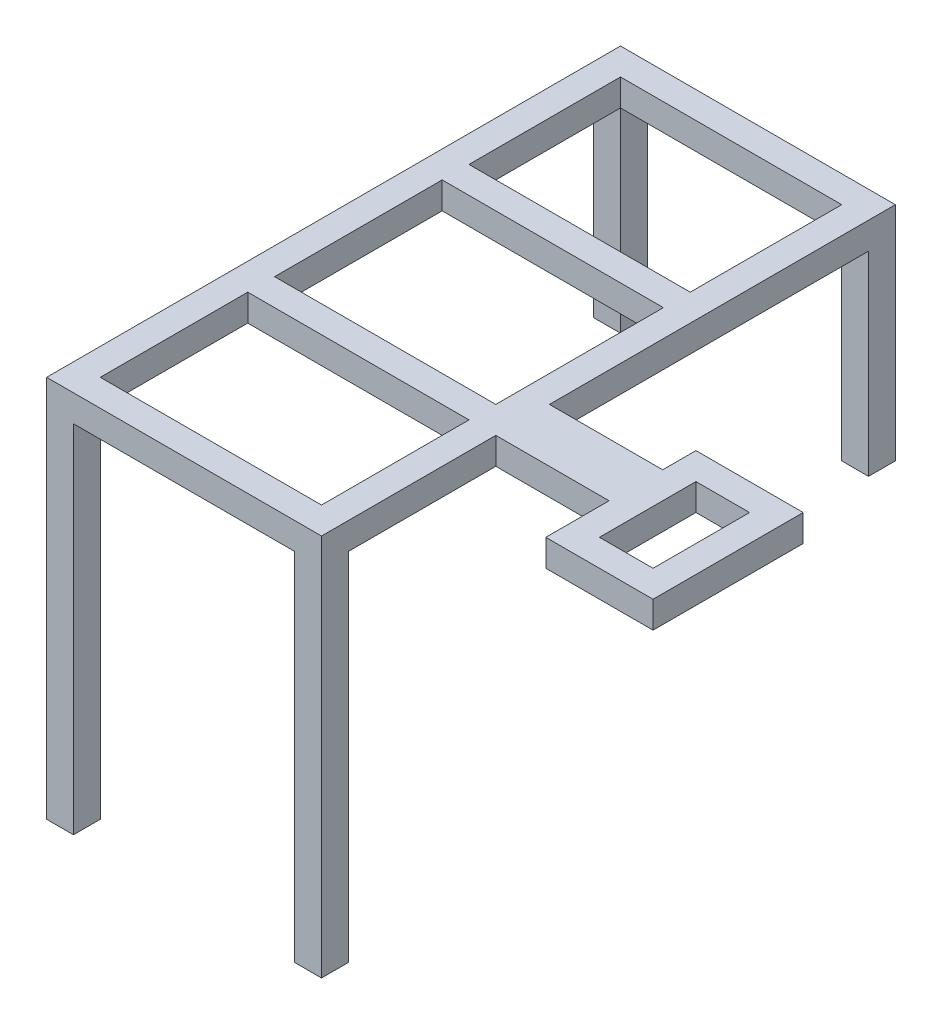
from build123d import *

# Parameters (mm, degrees)
SKETCH2_W           = 260.35
SKETCH2_H           = 209.55
SKETCH2_W_2         = 209.55
SKETCH2_H_2         = 158.75
SKETCH2_W_3         = 50.8
SKETCH2_H_3         = 91.44
SKETCH2_W_4         = 107.2896
SKETCH2_H_4         = 50.8
BOSS_EXTRUDE1_DEPTH = 25.4
SKETCH3_W           = 260.35
SKETCH3_H           = 543.56
SKETCH3_W_2         = 209.55
SKETCH3_H_2         = 492.76
BOSS_EXTRUDE2_DEPTH = 25.4
SKETCH4_W           = 25.4
SKETCH4_H           = 25.4
BOSS_EXTRUDE3_DEPTH = 184.785
SKETCH5_W           = 25.4
SKETCH5_H           = 25.4
BOSS_EXTRUDE4_DEPTH = 337.185


with BuildPart() as part:
    # Sketch2 → Boss-Extrude1 (new body)
    # profile 1 of 3: a face of its own
    with BuildSketch(Plane(origin=(0, 0, 0), x_dir=(1, 0, 0), z_dir=(0, 1, 0))):
        with Locations((104.775, -79.375)):
            Rectangle(SKETCH2_W, SKETCH2_H)
        with Locations((104.775, -79.375)):
            Rectangle(SKETCH2_W_2, SKETCH2_H_2, mode=Mode.SUBTRACT)
    # profile 2 of 3: a face of its own
    with BuildSketch(Plane(origin=(0, 0, 0), x_dir=(1, 0, 0), z_dir=(0, 1, 0))):
        Polygon((342.2396, -133.35), (342.2396, -184.15), (342.2396, -244.094), (443.8396, -244.094), (443.8396, -101.854), (342.2396, -101.854), align=None)
        with Locations((393.0396, -172.974)):
            Rectangle(SKETCH2_W_3, SKETCH2_H_3, mode=Mode.SUBTRACT)
    # profile 3 of 3: a face of its own
    with BuildSketch(Plane(origin=(0, 0, 0), x_dir=(1, 0, 0), z_dir=(0, 1, 0))):
        with Locations((288.5948, -158.75)):
            Rectangle(SKETCH2_W_4, SKETCH2_H_4)
    extrude(amount=BOSS_EXTRUDE1_DEPTH)

    # Sketch3 → Boss-Extrude2 (add)
    with BuildSketch(Plane(origin=(0, 25.4, 0), x_dir=(1, 0, 0), z_dir=(0, 1, 0))):
        with Locations((104.775, -77.47)):
            Rectangle(SKETCH3_W, SKETCH3_H)
        with Locations((104.775, -77.47)):
            Rectangle(SKETCH3_W_2, SKETCH3_H_2, mode=Mode.SUBTRACT)
    extrude(amount=-BOSS_EXTRUDE2_DEPTH)

    # Sketch4 → Boss-Extrude3 (add)
    with BuildSketch(Plane.XZ):
        with Locations((-12.7, -181.61)):
            Rectangle(SKETCH4_W, SKETCH4_H)
        with Locations((222.25, -181.61)):
            Rectangle(SKETCH4_W, SKETCH4_H)
    extrude(amount=BOSS_EXTRUDE3_DEPTH)

    # Sketch5 → Boss-Extrude4 (add)
    with BuildSketch(Plane.XZ):
        with Locations((-12.7, 336.55)):
            Rectangle(SKETCH5_W, SKETCH5_H)
        with Locations((222.25, 336.55)):
            Rectangle(SKETCH5_W, SKETCH5_H)
    extrude(amount=BOSS_EXTRUDE4_DEPTH)


solid = part.part
